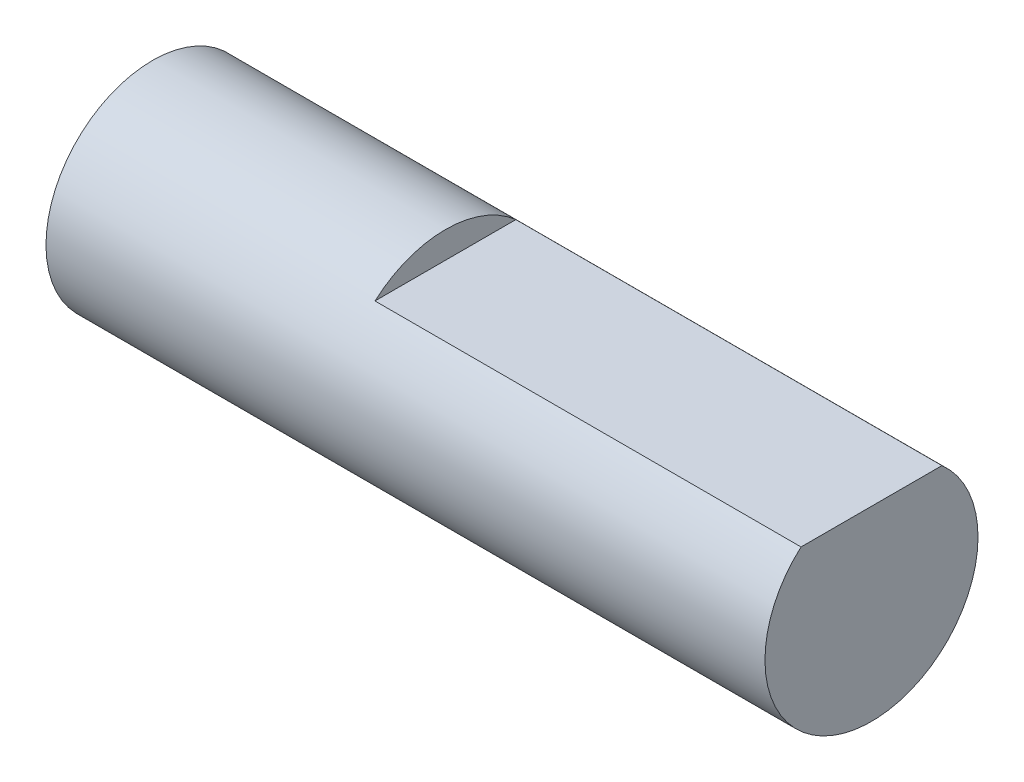
from build123d import *

# Parameters (mm, degrees)
SKETCH1_R               = 4
BOSS_EXTRUDE1_DEPTH     = 27
CUT_EXTRUDE1_DEPTH      = 28.586228448
CUT_EXTRUDE1_DEPTH_BACK = 16


with BuildPart() as part:
    # Sketch1 → Boss-Extrude1 (new body)
    with BuildSketch(Plane(origin=(0, 0, 0), x_dir=(0, 0, -1), z_dir=(1, 0, 0))):
        Circle(SKETCH1_R)
    extrude(amount=BOSS_EXTRUDE1_DEPTH)

    # Sketch3 → Cut-Extrude1 (cut, two sides: drawn at the far end of the back side and taken through both)
    with BuildSketch(Plane(origin=(27, 0, 0), x_dir=(0, 0, -1), z_dir=(1, 0, 0)).offset(-CUT_EXTRUDE1_DEPTH_BACK)):
        Polygon((-31.950259643, 3), (-2.645751311, 3), (2.645751311, 3), (31.950259643, 3), (31.950259643, 61.609016665), (-31.950259643, 61.609016665), align=None)
    extrude(amount=CUT_EXTRUDE1_DEPTH + CUT_EXTRUDE1_DEPTH_BACK, mode=Mode.SUBTRACT)


solid = part.part
